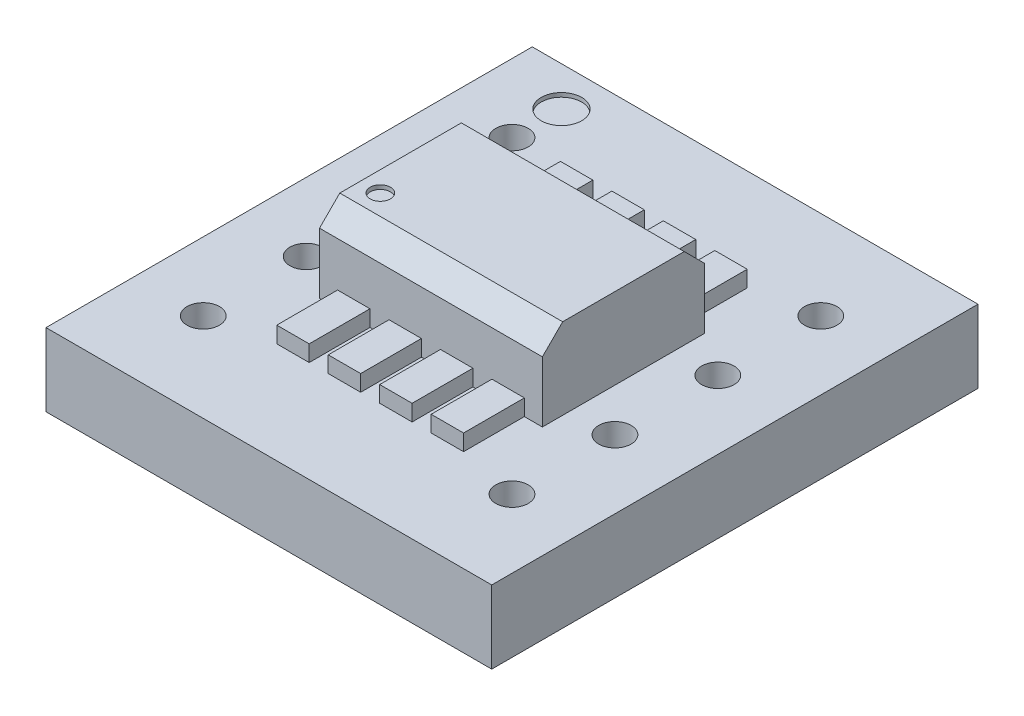
from build123d import *

# Parameters (mm, degrees)
SKETCH1_W               = 11
SKETCH1_H               = 12
BOSS_EXTRUDE1_DEPTH     = 1.8
SKETCH2_W               = 2.54
SKETCH2_H               = 10.16
BOSS_EXTRUDE2_DEPTH     = 2.54
BOSS_EXTRUDE3_START     = -5.84
SKETCH3_W               = 0.5
SKETCH3_H               = 0.5
BOSS_EXTRUDE3_DEPTH     = 12.34
SKETCH4_W               = 5.5
SKETCH4_H               = 4
BOSS_EXTRUDE4_DEPTH     = 2
CHAMFER1_SIZE           = 0.5
SKETCH5_W               = 0.8
SKETCH5_H               = 7
BOSS_EXTRUDE5_DEPTH     = 0.4
SKETCH6_R               = 0.5
CUT_EXTRUDE1_DEPTH      = 0.1
SKETCH7_R               = 0.25
CUT_EXTRUDE2_DEPTH      = 0.1
SKETCH9_W               = 11
SKETCH9_H               = 12
CUT_EXTRUDE3_DEPTH      = 31
CUT_EXTRUDE4_DEPTH      = 9.381527307
CUT_EXTRUDE4_DEPTH_BACK = 9.381527307
SKETCH10_R              = 0.4


with BuildPart() as part:
    # Sketch1 → Boss-Extrude1 (new body)
    with BuildSketch(Plane(origin=(0, 0, 0), x_dir=(1, 0, 0), z_dir=(0, 1, 0))):
        Rectangle(SKETCH1_W, SKETCH1_H)
    extrude(amount=BOSS_EXTRUDE1_DEPTH)

    # Sketch2 → Boss-Extrude2 (add)
    with BuildSketch(Plane.XZ):
        with Locations((-3.81, 0)):
            Rectangle(SKETCH2_W, SKETCH2_H)
        with Locations((3.81, 0)):
            Rectangle(SKETCH2_W, SKETCH2_H)
    extrude(amount=BOSS_EXTRUDE2_DEPTH)

    # Sketch3 → Boss-Extrude3 (add)
    with BuildSketch(Plane.XZ.offset(2.54).offset(BOSS_EXTRUDE3_START)):
        with Locations((3.81, 1.27)):
            Rectangle(SKETCH3_W, SKETCH3_H)
        with Locations((3.81, 3.81)):
            Rectangle(SKETCH3_W, SKETCH3_H)
        with Locations((3.81, -1.27)):
            Rectangle(SKETCH3_W, SKETCH3_H)
        with Locations((3.81, -3.81)):
            Rectangle(SKETCH3_W, SKETCH3_H)
    boss_extrude3 = extrude(amount=BOSS_EXTRUDE3_DEPTH)

    # Mirror1: Boss-Extrude3 across plane
    add(boss_extrude3.mirror(Plane(origin=(0, 0, 0), x_dir=(0, 0, 1), z_dir=(1, 0, 0))))

    # Sketch4 → Boss-Extrude4 (add)
    with BuildSketch(Plane(origin=(0, 1.8, 0), x_dir=(1, 0, 0), z_dir=(0, 1, 0))):
        Rectangle(SKETCH4_W, SKETCH4_H)
    extrude(amount=BOSS_EXTRUDE4_DEPTH)

    # Chamfer1
    chamfer1_edges = [part.edges().sort_by_distance(p)[0] for p in [
        (0, 3.8, -2),
        (0, 3.8, 2),
    ]]
    chamfer(chamfer1_edges, length=CHAMFER1_SIZE)

    # Sketch5 → Boss-Extrude5 (add)
    with BuildSketch(Plane(origin=(0, 1.8, 0), x_dir=(1, 0, 0), z_dir=(0, 1, 0))):
        with Locations((-0.635, 0)):
            Rectangle(SKETCH5_W, SKETCH5_H)
        with Locations((-1.905, 0)):
            Rectangle(SKETCH5_W, SKETCH5_H)
        with Locations((0.635, 0)):
            Rectangle(SKETCH5_W, SKETCH5_H)
        with Locations((1.905, 0)):
            Rectangle(SKETCH5_W, SKETCH5_H)
    extrude(amount=BOSS_EXTRUDE5_DEPTH)

    # Sketch6 → Cut-Extrude1 (cut)
    with BuildSketch(Plane(origin=(0, 1.8, 0), x_dir=(1, 0, 0), z_dir=(0, 1, 0))):
        with Locations(Location((-3.81, 5.03, 0), (0, 0, 270))):
            Circle(SKETCH6_R)
    extrude(amount=-CUT_EXTRUDE1_DEPTH, mode=Mode.SUBTRACT)

    # Sketch7 → Cut-Extrude2 (cut)
    with BuildSketch(Plane(origin=(0, 3.8, 0), x_dir=(1, 0, 0), z_dir=(0, 1, 0))):
        with Locations(Location((-2.25, -1, 0), (0, 0, 270))):
            Circle(SKETCH7_R)
    extrude(amount=-CUT_EXTRUDE2_DEPTH, mode=Mode.SUBTRACT)

    # Sketch9 → Cut-Extrude3 (cut)
    with BuildSketch(Plane.XZ):
        Rectangle(SKETCH9_W, SKETCH9_H)
    extrude(amount=CUT_EXTRUDE3_DEPTH, mode=Mode.SUBTRACT)

    # Sketch10 → Cut-Extrude4 (cut, two sides: drawn at the far end of the back side and taken through both)
    with BuildSketch(Plane(origin=(0, 1.8, 0), x_dir=(1, 0, 0), z_dir=(0, 1, 0)).offset(-CUT_EXTRUDE4_DEPTH_BACK)):
        with Locations(Location((-3.81, -3.81, 0), (0, 0, 270))):
            Circle(SKETCH10_R)
        with Locations(Location((-3.81, -1.27, 0), (0, 0, 270))):
            Circle(SKETCH10_R)
        with Locations(Location((-3.81, 1.27, 0), (0, 0, 270))):
            Circle(SKETCH10_R)
        with Locations(Location((-3.81, 3.81, 0), (0, 0, 270))):
            Circle(SKETCH10_R)
        with Locations(Location((3.81, -3.81, 0), (0, 0, 90))):
            Circle(SKETCH10_R)
        with Locations(Location((3.81, -1.27, 0), (0, 0, 90))):
            Circle(SKETCH10_R)
        with Locations(Location((3.81, 1.27, 0), (0, 0, 90))):
            Circle(SKETCH10_R)
        with Locations(Location((3.81, 3.81, 0), (0, 0, 90))):
            Circle(SKETCH10_R)
    extrude(amount=CUT_EXTRUDE4_DEPTH + CUT_EXTRUDE4_DEPTH_BACK, mode=Mode.SUBTRACT)


solid = part.part
